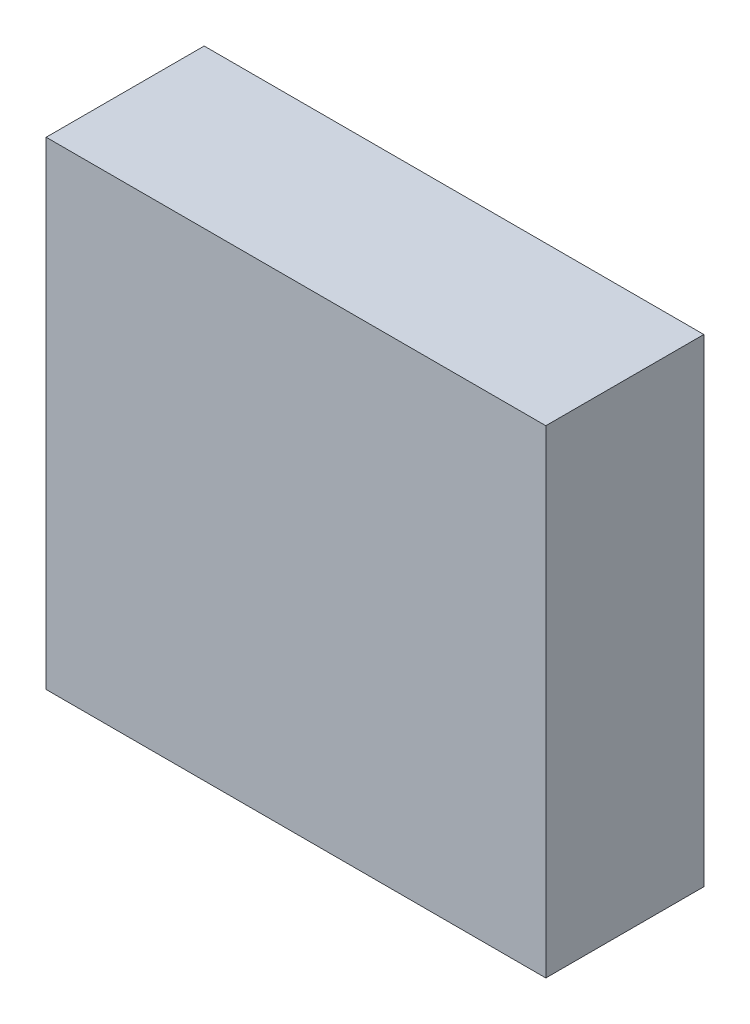
from build123d import *

# Parameters (mm, degrees)
SKETCH_1_W      = 117
SKETCH_1_H      = 112
EXTRUDE_1_DEPTH = 37


with BuildPart() as part:
    # 草图1 → 凸台-拉伸1 (new body)
    with BuildSketch(Plane.XY):
        Rectangle(SKETCH_1_W, SKETCH_1_H)
    extrude(amount=EXTRUDE_1_DEPTH)


solid = part.part
